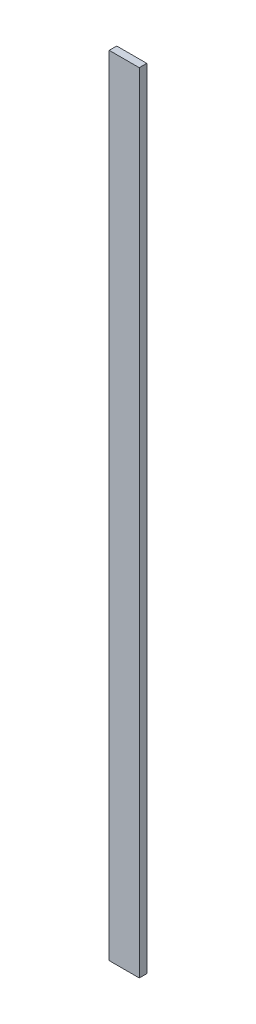
from build123d import *

# Parameters (mm, degrees)
SKETCH1_W           = 315
SKETCH1_H           = 12
BOSS_EXTRUDE1_DEPTH = 3


with BuildPart() as part:
    # Sketch1 → Boss-Extrude1 (new body)
    with BuildSketch(Plane(origin=(0, 0, 0), x_dir=(0, 1, 0), z_dir=(0, 0, 1))):
        Rectangle(SKETCH1_W, SKETCH1_H)
    extrude(amount=BOSS_EXTRUDE1_DEPTH)


solid = part.part
